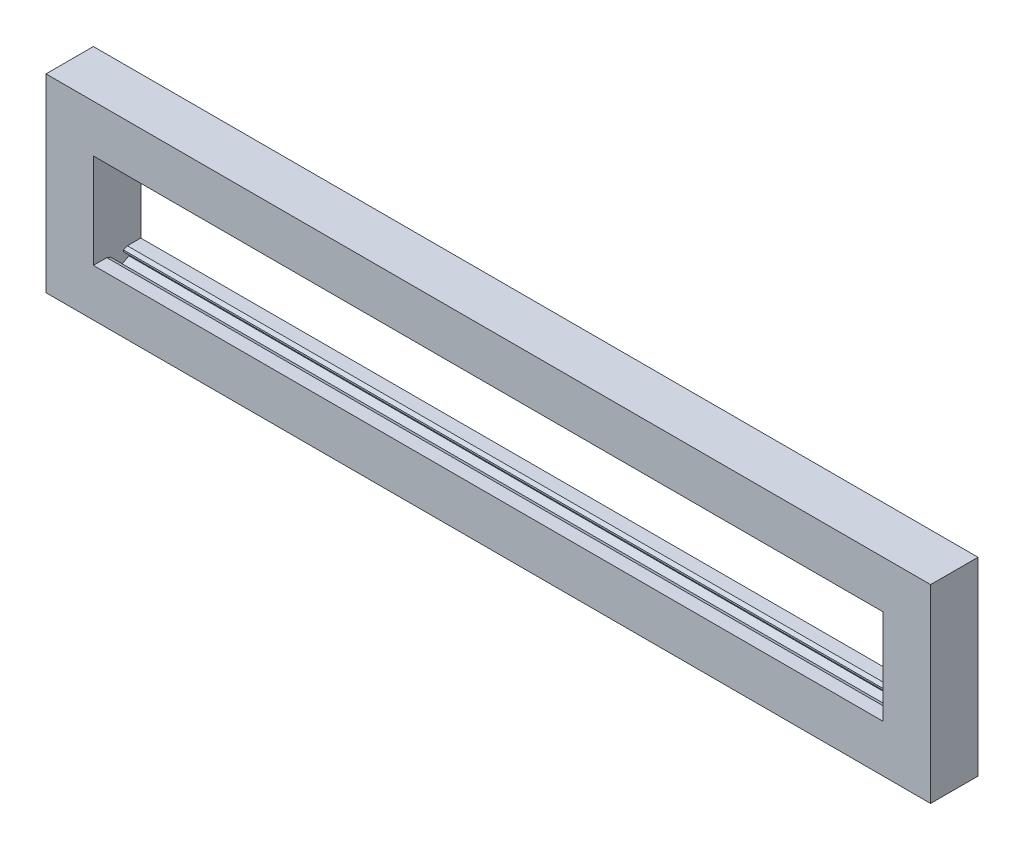
from build123d import *

# Parameters (mm, degrees)
SKETCH1_W           = 560
SKETCH1_H           = 120
SKETCH1_W_2         = 500
SKETCH1_H_2         = 60
BOSS_EXTRUDE1_DEPTH = 15
CUT_EXTRUDE1_DEPTH  = 250


with BuildPart() as part:
    # Sketch1 → Boss-Extrude1 (new, symmetric)
    with BuildSketch(Plane.XY):
        Rectangle(SKETCH1_W, SKETCH1_H)
        Rectangle(SKETCH1_W_2, SKETCH1_H_2, mode=Mode.SUBTRACT)
    extrude(amount=BOSS_EXTRUDE1_DEPTH, both=True)

    # Sketch2 → Cut-Extrude1 (cut, symmetric)
    with BuildSketch(Plane(origin=(0, 0, 0), x_dir=(0, 0, -1), z_dir=(1, 0, 0))):
        Polygon((-4, 31), (-6.5, 30), (6.5, 30), (4, 31), (4, 32), (7.5, 32), (7.5, 36), (0, 40), (-7.5, 36), (-7.5, 32), (-4, 32), align=None)
        Polygon((-6.5, -30), (6.5, -30), (4, -31), (4, -32), (7.5, -32), (7.5, -36), (0, -40), (-7.5, -36), (-7.5, -32), (-4, -32), (-4, -31), align=None)
    extrude(amount=CUT_EXTRUDE1_DEPTH, both=True, mode=Mode.SUBTRACT)


solid = part.part
